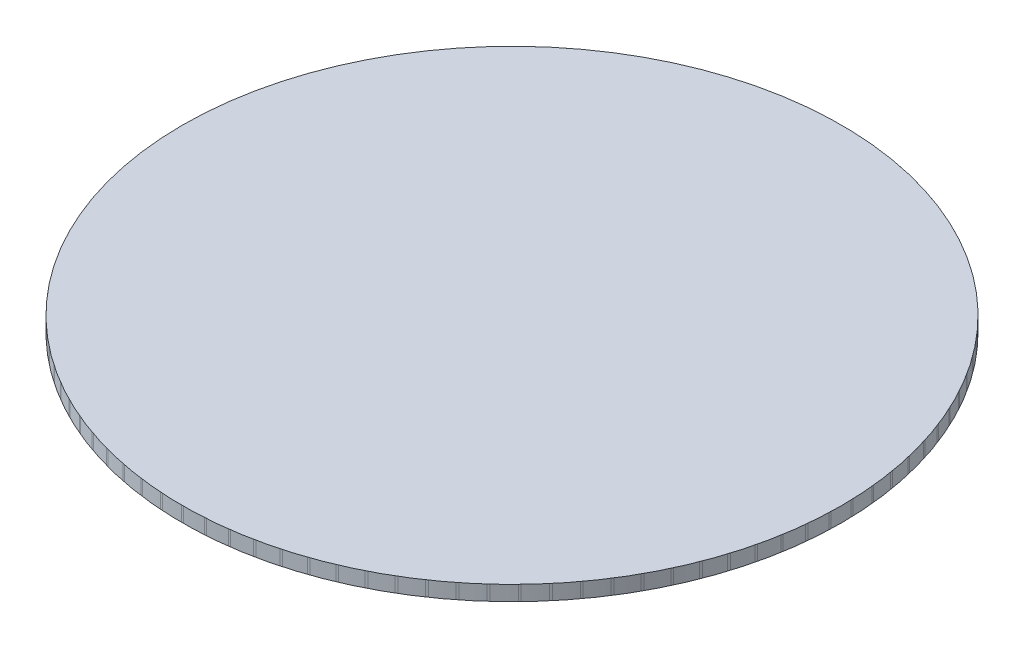
from build123d import *

# Parameters (mm, degrees)
SKETCH4_R           = 4402
SKETCH4_R_2         = 4400
EXTRUDE_THIN2_DEPTH = 200


with BuildPart() as part:
    # Sketch4 → Extrude-Thin2 (new body)
    with BuildSketch(Plane(origin=(0, 0, 0), x_dir=(1, 0, 0), z_dir=(0, 1, 0))):
        Circle(SKETCH4_R)
        Circle(SKETCH4_R_2, mode=Mode.SUBTRACT)
    extrude(amount=EXTRUDE_THIN2_DEPTH)


solid = part.part
